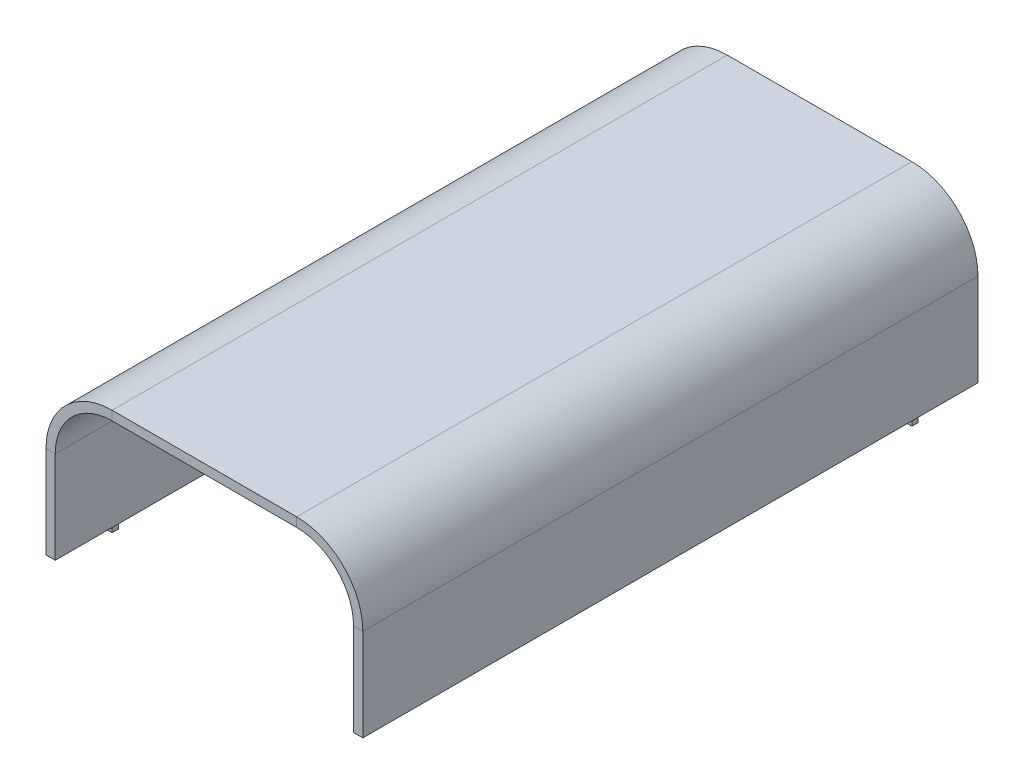
from build123d import *

# Parameters (mm, degrees)
SKETCH2_W           = 15
SKETCH2_H           = 1000
SKETCH3_W           = 10
SKETCH3_H           = 10
BOSS_EXTRUDE1_DEPTH = 10
SKETCH3_3_W         = 10
SKETCH3_3_H         = 10
CUT_EXTRUDE1_DEPTH  = 10


with BuildPart() as part:
    # Sweep1: sweep along a path in Sketch1
    with BuildLine(Plane.XY) as sweep1_path:
        Line((-250, 0), (-250, 150))
        ThreePointArc((-250, 150), (-220.710678119, 220.710678119), (-150, 250))
        Line((-150, 250), (150, 250))
        ThreePointArc((150, 250), (220.710678119, 220.710678119), (250, 150))
        Line((250, 150), (250, 0))
    # Sketch2 → Sweep1 (sweep)
    with BuildSketch(Plane(origin=(0, 0, 0), x_dir=(1, 0, 0), z_dir=(0, 1, 0))):
        with Locations((-250, 0)):
            Rectangle(SKETCH2_W, SKETCH2_H)
    sweep(path=sweep1_path.line)

    # Sketch3 → Boss-Extrude1 (add)
    with BuildSketch(Plane.XZ):
        with Locations((-250, 400)):
            Rectangle(SKETCH3_W, SKETCH3_H)
        with Locations((250, -400)):
            Rectangle(SKETCH3_W, SKETCH3_H)
    extrude(amount=BOSS_EXTRUDE1_DEPTH)

    # Sketch3<3> → Cut-Extrude1 (cut)
    with BuildSketch(Plane.XZ):
        with Locations((250, 400)):
            Rectangle(SKETCH3_3_W, SKETCH3_3_H)
        with Locations((-250, -400)):
            Rectangle(SKETCH3_3_W, SKETCH3_3_H)
    extrude(amount=-CUT_EXTRUDE1_DEPTH, mode=Mode.SUBTRACT)


solid = part.part
